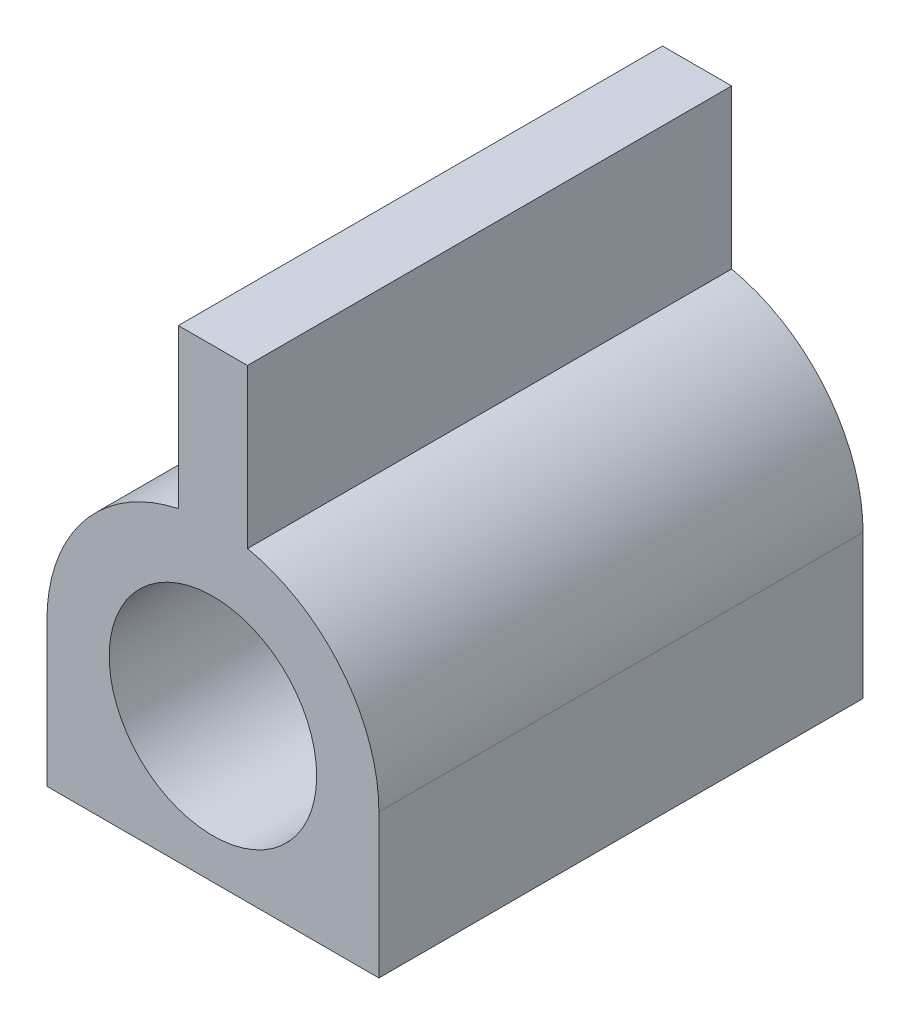
from build123d import *

# Parameters (mm, degrees)
SKETCH1_R           = 9.525
BOSS_EXTRUDE1_DEPTH = 22.225


with BuildPart() as part:
    # Sketch1 → Boss-Extrude1 (new, symmetric)
    with BuildSketch(Plane.XY):
        with BuildLine():
            Line((15.24, -13.208), (-15.24, -13.208))
            Line((-15.24, -13.208), (-15.24, 0))
            ThreePointArc((-15.24, 0), (-11.845771397, 9.588289733), (-3.175, 14.905602135))
            Line((-3.175, 14.905602135), (-3.175, 29.464))
            Line((-3.175, 29.464), (3.175, 29.464))
            Line((3.175, 29.464), (3.175, 14.905602135))
            ThreePointArc((3.175, 14.905602135), (11.845771397, 9.588289733), (15.24, 0))
            Line((15.24, 0), (15.24, -13.208))
        make_face()
        Circle(SKETCH1_R, mode=Mode.SUBTRACT)
    extrude(amount=BOSS_EXTRUDE1_DEPTH, both=True)


solid = part.part
